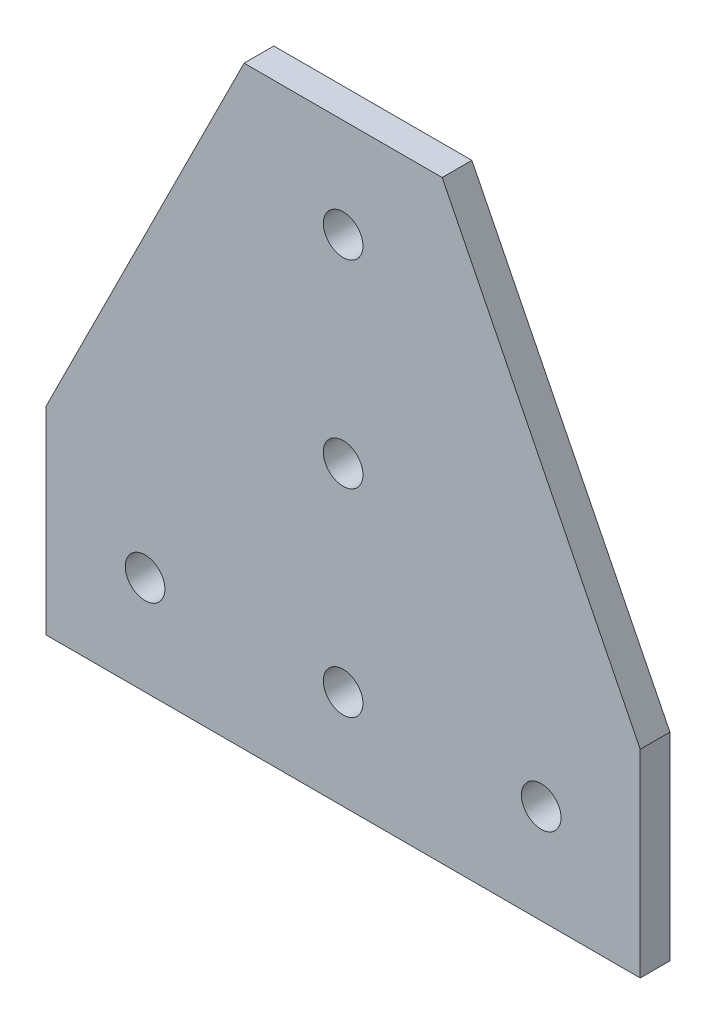
from build123d import *

# Parameters (mm, degrees)
SKETCH_1_R      = 2
EXTRUDE_1_DEPTH = 3


with BuildPart() as part:
    # 草图1 → 凸台-拉伸1 (new body)
    with BuildSketch(Plane.XY):
        Polygon((1.345968749, -83.366156353), (61.345968749, -83.366156353), (61.345968749, -63.366156353), (41.345968749, -23.366156353), (21.345968749, -23.366156353), (1.345968749, -63.366156353), align=None)
        with Locations((31.345968749, -33.366156353)):
            Circle(SKETCH_1_R, mode=Mode.SUBTRACT)
        with Locations((31.345968749, -53.366156353)):
            Circle(SKETCH_1_R, mode=Mode.SUBTRACT)
        with Locations((11.345968749, -73.366156353)):
            Circle(SKETCH_1_R, mode=Mode.SUBTRACT)
        with Locations((31.345968749, -73.366156353)):
            Circle(SKETCH_1_R, mode=Mode.SUBTRACT)
        with Locations((51.345968749, -73.366156353)):
            Circle(SKETCH_1_R, mode=Mode.SUBTRACT)
    extrude(amount=EXTRUDE_1_DEPTH)


solid = part.part
